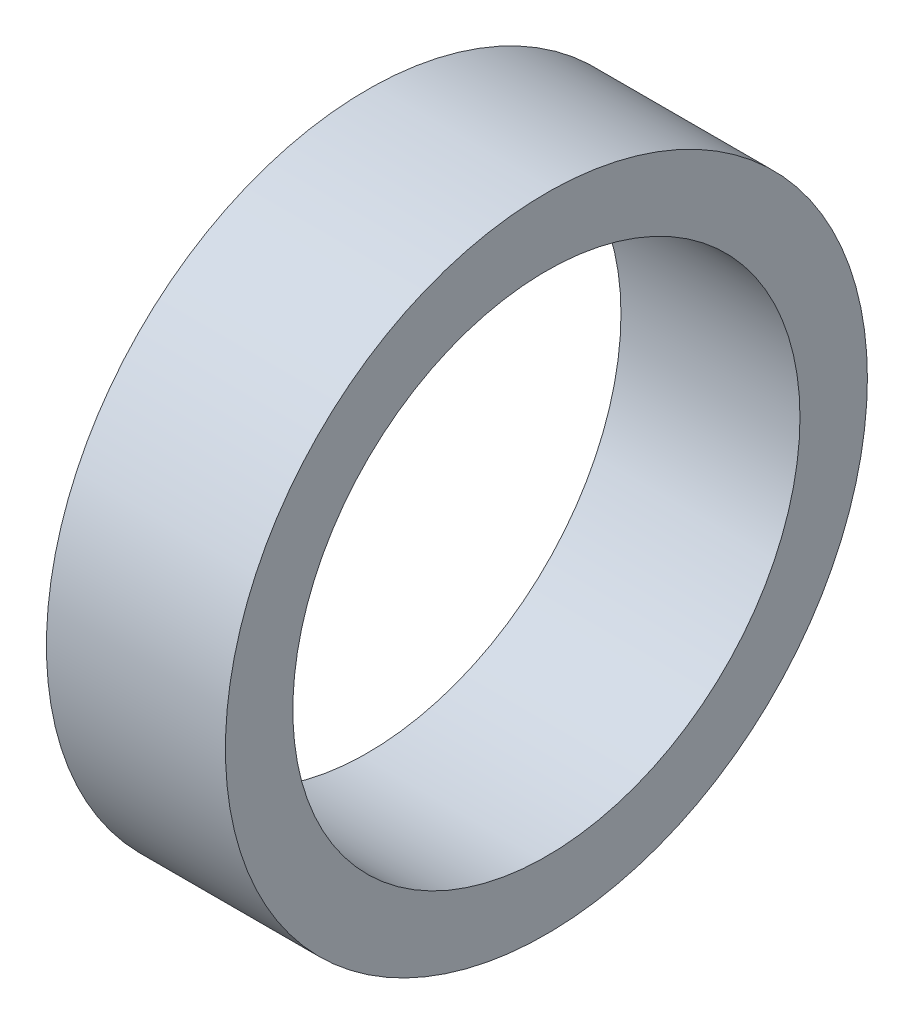
from build123d import *

# Parameters (mm, degrees)
SKETCH1_R           = 53.8
SKETCH1_R_2         = 42.5
SKETCH1_R_3         = 2.8
BOSS_EXTRUDE1_DEPTH = 20
SKETCH3_R           = 53.8
SKETCH3_R_2         = 42.5
BOSS_EXTRUDE2_DEPTH = 10


with BuildPart() as part:
    # Sketch1 → Boss-Extrude1 (new body)
    with BuildSketch(Plane(origin=(0, 0, 0), x_dir=(0, 0, -1), z_dir=(1, 0, 0))):
        Circle(SKETCH1_R)
        Circle(SKETCH1_R_2, mode=Mode.SUBTRACT)
        with Locations((0, 48)):
            Circle(SKETCH1_R_3, mode=Mode.SUBTRACT)
        with Locations((48, 0)):
            Circle(SKETCH1_R_3, mode=Mode.SUBTRACT)
        with Locations((0, -48)):
            Circle(SKETCH1_R_3, mode=Mode.SUBTRACT)
        with Locations((-48, 0)):
            Circle(SKETCH1_R_3, mode=Mode.SUBTRACT)
    extrude(amount=BOSS_EXTRUDE1_DEPTH)

    # Sketch3 → Boss-Extrude2 (add)
    with BuildSketch(Plane(origin=(20, 0, 0), x_dir=(0, 0, -1), z_dir=(1, 0, 0))):
        Circle(SKETCH3_R)
        Circle(SKETCH3_R_2, mode=Mode.SUBTRACT)
    extrude(amount=BOSS_EXTRUDE2_DEPTH)


solid = part.part
